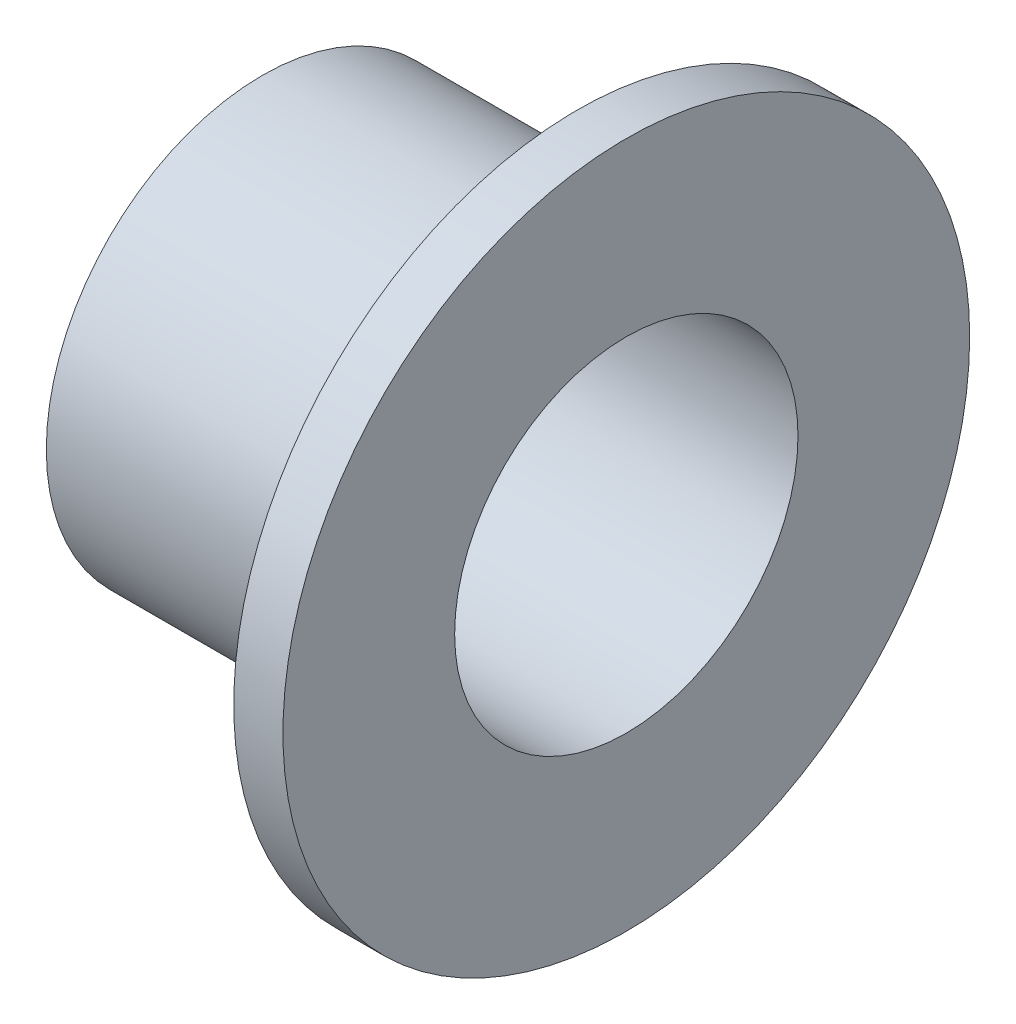
from build123d import *

# Parameters (mm, degrees)
SKETCH_1_R          = 3.775
EXTRUDE_1_DEPTH     = 5.5
SKETCH_2_R          = 6
EXTRUDE_2_DEPTH     = 0.86
SKETCH_3_R          = 3
CUT_EXTRUDE_1_DEPTH = 11.604225573


with BuildPart() as part:
    # Эскиз1 → Бобышка-Вытянуть1 (new body)
    with BuildSketch(Plane(origin=(0, 0, 0), x_dir=(0, 0, -1), z_dir=(1, 0, 0))):
        Circle(SKETCH_1_R)
    extrude(amount=EXTRUDE_1_DEPTH)

    # Эскиз2 → Бобышка-Вытянуть2 (add)
    with BuildSketch(Plane(origin=(5.5, 0, 0), x_dir=(0, 0, -1), z_dir=(1, 0, 0))):
        Circle(SKETCH_2_R)
    extrude(amount=EXTRUDE_2_DEPTH)

    # Эскиз3 → Вырез-Вытянуть1 (cut, through all)
    with BuildSketch(Plane(origin=(6.36, 0, 0), x_dir=(0, 0, -1), z_dir=(1, 0, 0))):
        Circle(SKETCH_3_R)
    extrude(amount=-CUT_EXTRUDE_1_DEPTH, mode=Mode.SUBTRACT)


solid = part.part
